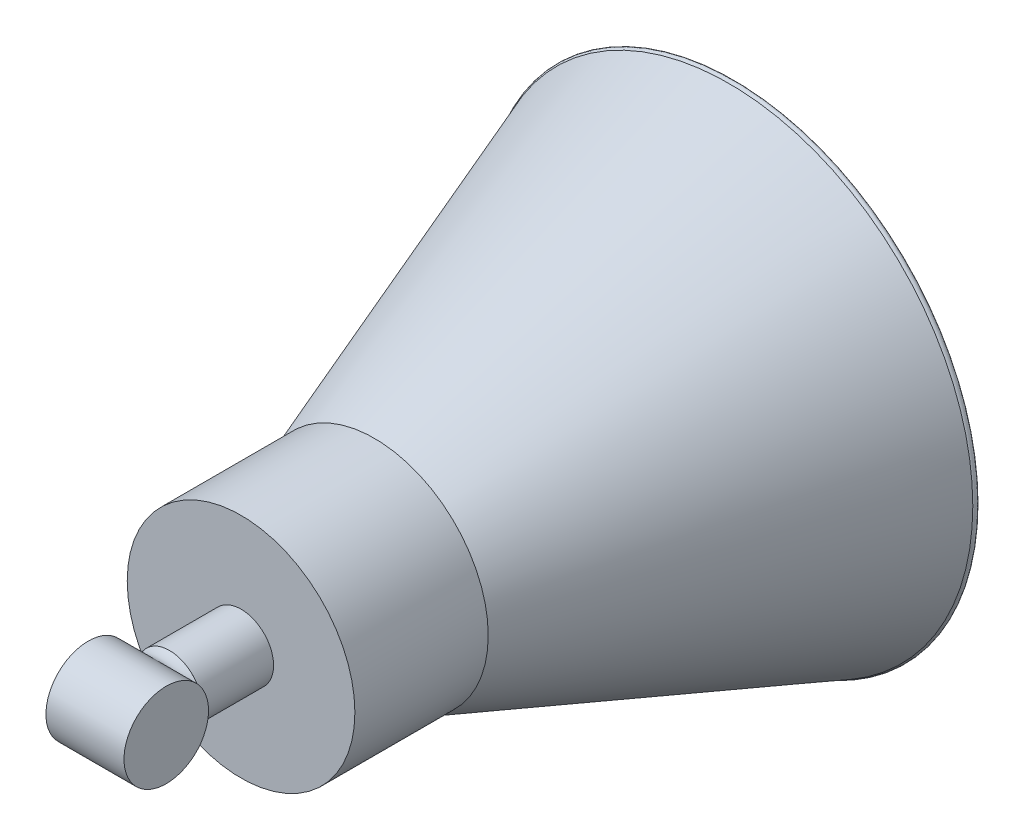
from build123d import *

# Parameters (mm, degrees)
SKETCH1_R                = 20
BOSS_EXTRUDE1_DEPTH      = 20
SKETCH2_R                = 19
CUT_EXTRUDE1_DEPTH       = 19
SKETCH7_R                = 35
SKETCH7_R_2              = 34
BOSS_EXTRUDE4_DEPTH      = 40
SKETCH8_R                = 35
BOSS_EXTRUDE5_DEPTH      = 1
SKETCH11_R               = 10
BOSS_EXTRUDE6_DEPTH      = 22
BOSS_EXTRUDE8_DEPTH      = 12
BOSS_EXTRUDE8_DEPTH_BACK = 12
SKETCH13_R               = 13


with BuildPart() as part:
    # Sketch1 → Boss-Extrude1 (new body)
    with BuildSketch(Plane.XY):
        Circle(SKETCH1_R)
    extrude(amount=BOSS_EXTRUDE1_DEPTH)

    # Sketch2 → Cut-Extrude1 (cut)
    with BuildSketch(Plane.XY):
        Circle(SKETCH2_R)
    extrude(amount=CUT_EXTRUDE1_DEPTH, mode=Mode.SUBTRACT)

    # Sketch4 → Revolve1 (revolve)
    with BuildSketch(Plane(origin=(0, 0, 0), x_dir=(1, 0, 0), z_dir=(0, 1, 0))):
        with BuildLine():
            Line((-31.749205416, 30), (-31.354964174, 30.307528605))
            ThreePointArc((-31.354964174, 30.307528605), (-22.096339308, 16.409802337), (-19, 0))
            Line((-19, 0), (-20, 0))
            ThreePointArc((-20, 0), (-22.940890323, 16.148959648), (-31.749205416, 30))
        make_face()
    revolve(axis=Axis((0, 0, 0), (0, 0, -1)))

    # Sketch5 → Revolve2 (revolve)
    with BuildSketch(Plane(origin=(0, 0, 0), x_dir=(1, 0, 0), z_dir=(0, 1, 0))):
        with BuildLine():
            Line((0, 85.001598795), (0, 84.056267465))
            ThreePointArc((0, 84.056267465), (-30.462587565, 65.594588425), (-31.275600385, 29.983609159))
            Line((-31.275600385, 29.983609159), (-31.749205416, 30))
            ThreePointArc((-31.749205416, 30), (-31.897957468, 66.750144741), (0, 85.001598795))
        make_face()
    revolve(axis=Axis((0, 0, -85.001598795), (0, 0, 1)))



with BuildPart() as body_2:
    # Sketch7 → Boss-Extrude4 (new body)
    with BuildSketch(Plane.XY.offset(20)):
        Circle(SKETCH7_R)
        Circle(SKETCH7_R_2, mode=Mode.SUBTRACT)
    extrude(amount=-BOSS_EXTRUDE4_DEPTH)


with BuildPart() as part_1:
    add(part.part)

    add(body_2.part)  # Boss-Extrude5 merges body 2
    # Sketch8 → Boss-Extrude5 (add)
    with BuildSketch(Plane.XY.offset(20)):
        Circle(SKETCH8_R)
    extrude(amount=BOSS_EXTRUDE5_DEPTH)

    # Sketch10 → Revolve3 (revolve)
    with BuildSketch(Plane(origin=(0, 0, 0), x_dir=(0, 0, -1), z_dir=(1, 0, 0))):
        with BuildLine():
            Line((20, 35), (129, 75))
            ThreePointArc((129, 75), (130.709704433, 74.5), (129, 74))
            Line((129, 74), (20, 34))
            Line((20, 34), (20, 35))
        make_face()
    revolve(axis=Axis((0, 0, 21), (0, 0, -1)))

    # Sketch11 → Boss-Extrude6 (add)
    with BuildSketch(Plane.XY.offset(21)):
        Circle(SKETCH11_R)
    extrude(amount=BOSS_EXTRUDE6_DEPTH)


with BuildPart() as body_2_2:
    # Sketch13 → Boss-Extrude8 (new, two sides: drawn at the far end of the back side and taken through both)
    with BuildSketch(Plane(origin=(0, 0, 0), x_dir=(0, 0, -1), z_dir=(1, 0, 0)).offset(-BOSS_EXTRUDE8_DEPTH_BACK)):
        with Locations((-56, 0)):
            Circle(SKETCH13_R)
    extrude(amount=BOSS_EXTRUDE8_DEPTH + BOSS_EXTRUDE8_DEPTH_BACK)

    # Sketch14 → Revolve4 (revolve)
    with BuildSketch(Plane(origin=(0, 0, 0), x_dir=(0, 0, -1), z_dir=(1, 0, 0))):
        with BuildLine():
            ThreePointArc((-48.596043492, 10.68557102), (-45.940008153, 9.183806955), (-43, 10))
            ThreePointArc((-43, 10), (-45.928180787, 9.28034904), (-48.596043492, 10.68557102))
        make_face()
    revolve(axis=Axis((0, 0, 0), (0, 0, 1)))


solid = Compound([part_1.part, body_2_2.part])
